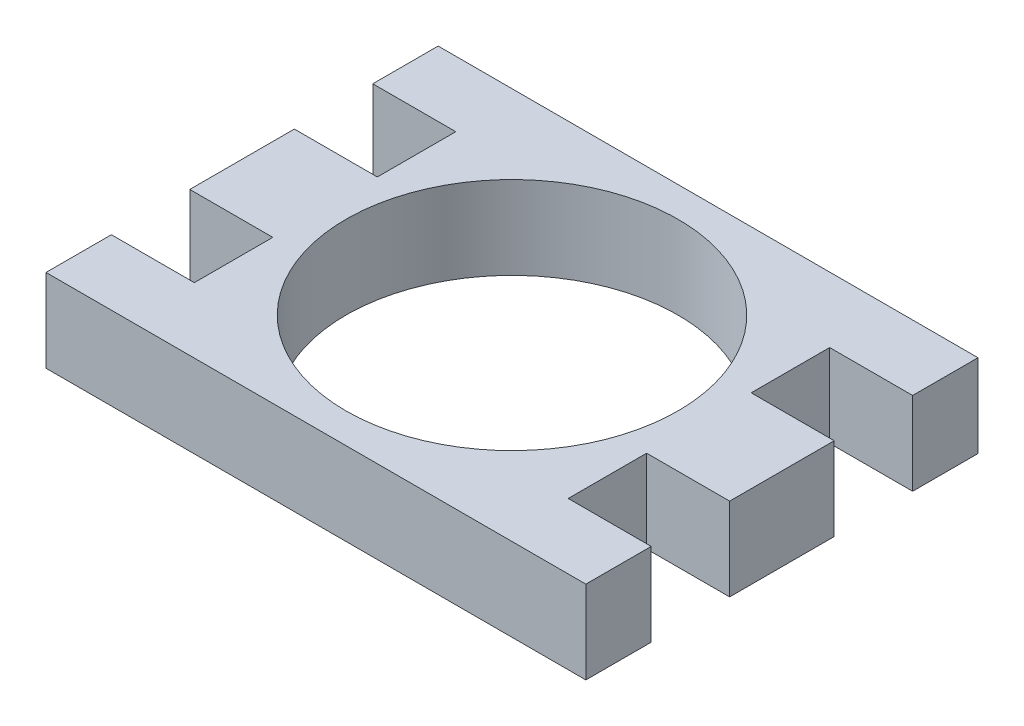
from build123d import *

# Parameters (mm, degrees)
SKETCH1_R           = 12.7
BOSS_EXTRUDE1_DEPTH = 6.35


with BuildPart() as part:
    # Sketch1 → Boss-Extrude1 (new body)
    with BuildSketch(Plane(origin=(0, 0, 0), x_dir=(1, 0, 0), z_dir=(0, 1, 0))):
        Polygon((-20.65, 15), (20.65, 15), (20.65, 10), (14.3, 10), (14.3, 4), (20.65, 4), (20.65, -4), (14.3, -4), (14.3, -10), (20.65, -10), (20.65, -15), (-20.65, -15), (-20.65, -10), (-14.3, -10), (-14.3, -4), (-20.65, -4), (-20.65, 4), (-14.3, 4), (-14.3, 10), (-20.65, 10), align=None)
        with Locations(Location((0, 0, 0), (0, 0, 270))):
            Circle(SKETCH1_R, mode=Mode.SUBTRACT)
    extrude(amount=BOSS_EXTRUDE1_DEPTH)


solid = part.part
